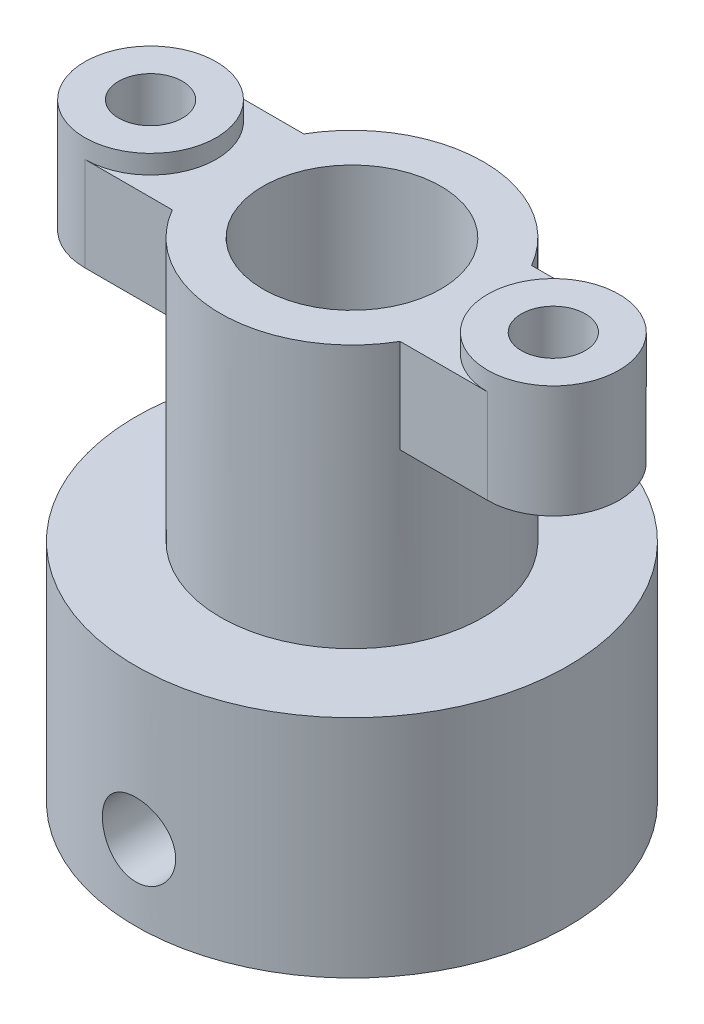
from build123d import *

# Parameters (mm, degrees)
ESQUISSE1_R                  = 1.7
BOSS_EXTRU_1_DEPTH           = 5
ESQUISSE2_R                  = 3.5
ESQUISSE2_R_2                = 1.7
BOSS_EXTRU_2_DEPTH           = 1
BOSS_EXTRU_3_START           = 9
ESQUISSE5_R                  = 7
BOSS_EXTRU_3_DEPTH           = 9
ESQUISSE6_R                  = 11.5
BOSS_EXTRU_4_DEPTH           = 2
ESQUISSE7_R                  = 4.739811
ENL_V_MAT_EXTRU_1_DEPTH      = 10
ESQUISSE8_R                  = 11.5
ESQUISSE8_R_2                = 6.75
BOSS_EXTRU_5_DEPTH           = 10
ESQUISSE10_R                 = 6.9395
ESQUISSE10_R_2               = 6.2
BOSS_EXTRU_6_DEPTH           = 10
ENL_V_MAT_EXTRU_2_DEPTH      = 28.847054
ENL_V_MAT_EXTRU_2_DEPTH_BACK = 28.847054
ESQUISSE9_R                  = 1.95
BOSS_EXTRU_7_DEPTH           = 4
ESQUISSE12_R                 = 9
ENL_V_MAT_EXTRU_3_DEPTH      = 2


with BuildPart() as part:
    # Esquisse1 → Boss.-Extru.1 (new body)
    with BuildSketch(Plane(origin=(0, 0, 0), x_dir=(1, 0, 0), z_dir=(0, 1, 0))):
        with BuildLine():
            Line((-10.72, 3.5), (-6.062178, 3.5))
            ThreePointArc((-6.062178, 3.5), (0, 7), (6.062178, 3.5))
            Line((6.062178, 3.5), (10.72, 3.5))
            ThreePointArc((10.72, 3.5), (14.22, 0), (10.72, -3.5))
            Line((10.72, -3.5), (6.062178, -3.5))
            ThreePointArc((6.062178, -3.5), (0, -7), (-6.062178, -3.5))
            Line((-6.062178, -3.5), (-10.72, -3.5))
            ThreePointArc((-10.72, -3.5), (-14.22, 0), (-10.72, 3.5))
        make_face()
        with Locations(Location((10.72, 0, 0), (0, 0, 270))):
            Circle(ESQUISSE1_R, mode=Mode.SUBTRACT)
        with Locations(Location((-10.72, 0, 0), (0, 0, 270))):
            Circle(ESQUISSE1_R, mode=Mode.SUBTRACT)
    extrude(amount=BOSS_EXTRU_1_DEPTH)

    # Esquisse2 → Boss.-Extru.2 (add)
    # profile 1 of 2: a face of its own
    with BuildSketch(Plane(origin=(0, 5, 0), x_dir=(1, 0, 0), z_dir=(0, 1, 0))):
        with Locations(Location((-10.72, 0, 0), (0, 0, 270))):
            Circle(ESQUISSE2_R)
        with Locations(Location((-10.72, 0, 0), (0, 0, 270))):
            Circle(ESQUISSE2_R_2, mode=Mode.SUBTRACT)
    # profile 2 of 2: a face of its own
    with BuildSketch(Plane(origin=(0, 5, 0), x_dir=(1, 0, 0), z_dir=(0, 1, 0))):
        with Locations(Location((10.72, 0, 0), (0, 0, 270))):
            Circle(ESQUISSE2_R)
        with Locations(Location((10.72, 0, 0), (0, 0, 270))):
            Circle(ESQUISSE2_R_2, mode=Mode.SUBTRACT)
    extrude(amount=BOSS_EXTRU_2_DEPTH)

    # Esquisse5 → Boss.-Extru.3 (add)
    with BuildSketch(Plane.XZ.offset(BOSS_EXTRU_3_START)):
        with Locations(Location((0, 0, 0), (0, 0, 270))):
            Circle(ESQUISSE5_R)
    extrude(amount=-BOSS_EXTRU_3_DEPTH)

    # Esquisse6 → Boss.-Extru.4 (add)
    with BuildSketch(Plane.XZ.offset(9)):
        with Locations(Location((0, 0, 0), (0, 0, 270))):
            Circle(ESQUISSE6_R)
    extrude(amount=BOSS_EXTRU_4_DEPTH)

    # Esquisse7 → Enlèv. mat.-Extru.1 (cut)
    with BuildSketch(Plane(origin=(0, 5, 0), x_dir=(1, 0, 0), z_dir=(0, 1, 0))):
        with Locations(Location((0, 0, 0), (0, 0, 270))):
            Circle(ESQUISSE7_R)
    extrude(amount=-ENL_V_MAT_EXTRU_1_DEPTH, mode=Mode.SUBTRACT)

    # Esquisse8 → Boss.-Extru.5 (add)
    with BuildSketch(Plane.XZ.offset(11)):
        with Locations(Location((0, 0, 0), (0, 0, 270))):
            Circle(ESQUISSE8_R)
        with Locations(Location((0, 0, 0), (0, 0, 270))):
            Circle(ESQUISSE8_R_2, mode=Mode.SUBTRACT)
    extrude(amount=BOSS_EXTRU_5_DEPTH)

    # Esquisse10 → Boss.-Extru.6 (add)
    with BuildSketch(Plane.XZ.offset(11)):
        Circle(ESQUISSE10_R)
        with Locations(Location((0, 0, 0), (0, 0, 90))):
            Circle(ESQUISSE10_R_2, mode=Mode.SUBTRACT)
    extrude(amount=BOSS_EXTRU_6_DEPTH)

    # Esquisse9 → Enlèv. mat.-Extru.2 (cut, two sides: drawn at the far end of the back side and taken through both)
    with BuildSketch(Plane.XY.offset(-ENL_V_MAT_EXTRU_2_DEPTH_BACK)):
        with Locations(Location((0, -17, 0), (0, 0, 270))):
            Circle(ESQUISSE9_R)
    extrude(amount=ENL_V_MAT_EXTRU_2_DEPTH + ENL_V_MAT_EXTRU_2_DEPTH_BACK, mode=Mode.SUBTRACT)

    # Esquisse11 → Boss.-Extru.7 (add)
    with BuildSketch(Plane.XZ.offset(11)):
        with BuildLine():
            Line((0, 6.2), (6.2, 0))
            ThreePointArc((6.2, 0), (4.384062, 4.384062), (0, 6.2))
        make_face()
    extrude(amount=BOSS_EXTRU_7_DEPTH)

    # Esquisse12 → Enlèv. mat.-Extru.3 (cut)
    with BuildSketch(Plane.XZ.offset(21)):
        with Locations(Location((0, 0, 0), (0, 0, 270))):
            Circle(ESQUISSE12_R)
    extrude(amount=-ENL_V_MAT_EXTRU_3_DEPTH, mode=Mode.SUBTRACT)


solid = part.part
